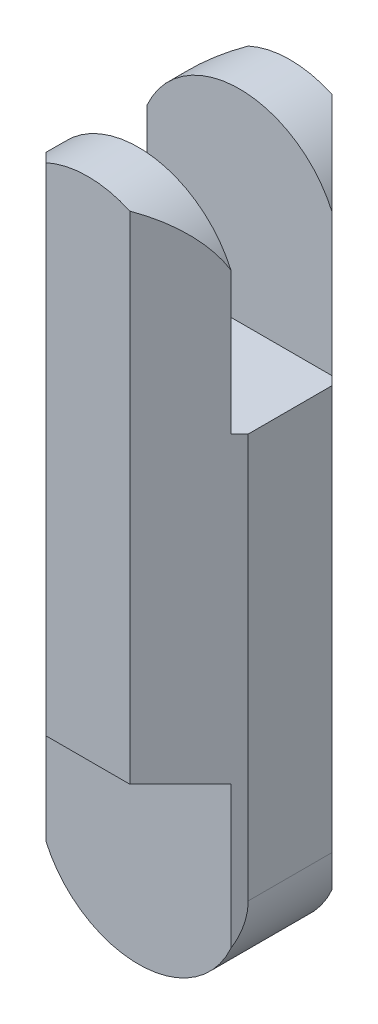
from build123d import *

# Parameters (mm, degrees)
EXTRUDE_1_DEPTH     = 70
CUT_EXTRUDE_1_DEPTH = 66
CUT_EXTRUDE_2_DEPTH = 5
CUT_EXTRUDE_START   = -5
CUT_EXTRUDE_3_DEPTH = 5
SKETCH_6_W          = 20
SKETCH_6_H          = 20
CUT_EXTRUDE_4_DEPTH = 5
CUT_EXTRUDE_5_DEPTH = 30


with BuildPart() as part:
    # 草图1 → 凸台-拉伸1 (new body)
    with BuildSketch(Plane(origin=(0, 0, 0), x_dir=(1, 0, 0), z_dir=(0, 1, 0))):
        Polygon((10, 4.142135624), (4.142135624, 10), (-4.142135624, 10), (-10, 4.142135624), (-10, -4.142135624), (-4.142135624, -10), (4.142135624, -10), (10, -4.142135624), align=None)
    extrude(amount=EXTRUDE_1_DEPTH)

    # 草图2 → 切除-拉伸1 (cut)
    with BuildSketch(Plane.XY.offset(10)):
        with BuildLine():
            Line((-10, 10), (-10, -2.389295552))
            Line((-10, -2.389295552), (10, -2.389295552))
            Line((10, -2.389295552), (10, 10))
            ThreePointArc((10, 10), (0, 0), (-10, 10))
        make_face()
    extrude(amount=-CUT_EXTRUDE_1_DEPTH, mode=Mode.SUBTRACT)

    # 草图4 → 切除-拉伸2 (cut)
    with BuildSketch(Plane.XY.offset(10)):
        with BuildLine():
            Line((-10, 10), (-10, 20))
            Line((-10, 20), (10, 20))
            Line((10, 20), (10, 10))
            ThreePointArc((10, 10), (0, 0), (-10, 10))
        make_face()
    extrude(amount=-CUT_EXTRUDE_2_DEPTH, mode=Mode.SUBTRACT)

    # 草图5 → 切除-拉伸3 (cut)
    with BuildSketch(Plane(origin=(0, 0, -10), x_dir=(-1, 0, 0), z_dir=(0, 0, -1)).offset(CUT_EXTRUDE_START)):
        with BuildLine():
            Line((-10, 10), (-10, 20))
            Line((-10, 20), (10, 20))
            Line((10, 20), (10, 10))
            ThreePointArc((10, 10), (0, 0), (-10, 10))
        make_face()
    extrude(amount=CUT_EXTRUDE_3_DEPTH, mode=Mode.SUBTRACT)

    # 草图6 → 切除-拉伸4 (cut, symmetric)
    with BuildSketch(Plane.XY):
        with Locations((0, 60)):
            Rectangle(SKETCH_6_W, SKETCH_6_H)
    extrude(amount=CUT_EXTRUDE_4_DEPTH, both=True, mode=Mode.SUBTRACT)

    # 草图7 → 切除-拉伸5 (cut)
    with BuildSketch(Plane.XY.offset(10)):
        with BuildLine():
            Line((-10, 60), (-10, 79.107913371))
            Line((-10, 79.107913371), (10, 79.107913371))
            Line((10, 79.107913371), (10, 60))
            ThreePointArc((10, 60), (0, 70), (-10, 60))
        make_face()
    extrude(amount=-CUT_EXTRUDE_5_DEPTH, mode=Mode.SUBTRACT)


solid = part.part
